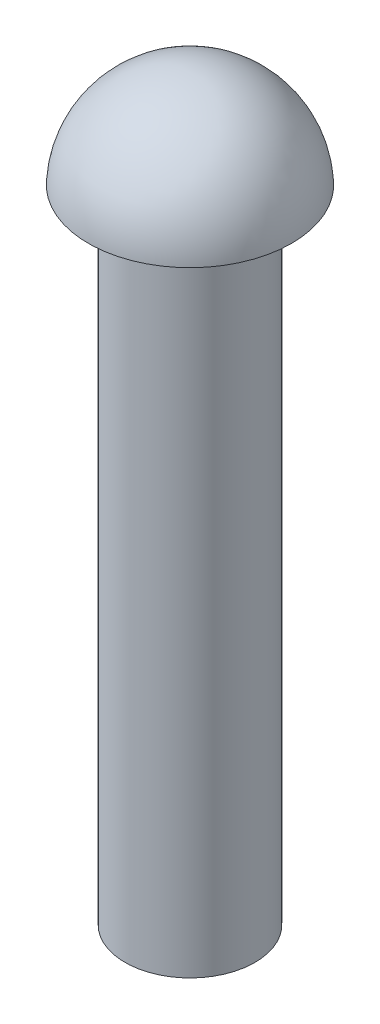
from build123d import *


with BuildPart() as part:
    # Sketch1 → Revolve1 (revolve)
    with BuildSketch(Plane.XY, mode=Mode.PRIVATE) as revolve1_sk:
        with BuildLine():
            Line((0, 0), (3.8608, 0))
            Line((3.8608, 0), (3.8608, 38.1))
            Line((3.8608, 38.1), (6.039861508, 38.1))
            ThreePointArc((6.039861508, 38.1), (4.183835695, 42.209480482), (0, 43.8912))
            Line((0, 43.8912), (0, 0))
        make_face()
    revolve(revolve1_sk.sketch.rotate(Axis((0, 0, 0), (0, 1, 0)), 90), axis=Axis((0, 0, 0), (0, 1, 0)))


solid = part.part
